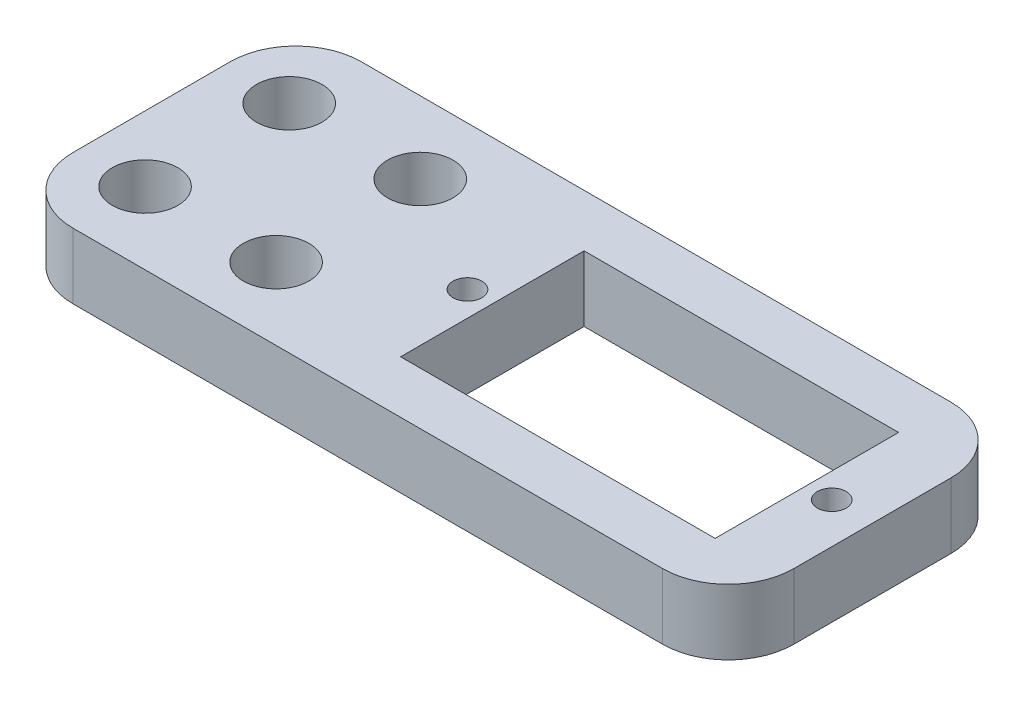
from build123d import *

# Parameters (mm, degrees)
SKETCH1_W           = 55
SKETCH1_H           = 22
BOSS_EXTRUDE1_DEPTH = 5
SKETCH2_R           = 2.5
CUT_EXTRUDE1_DEPTH  = 5
FILLET1_R           = 5
SKETCH4_R           = 1.1
SKETCH4_W           = 24
SKETCH4_H           = 14
CUT_EXTRUDE2_DEPTH  = 5


with BuildPart() as part:
    # Sketch1 → Boss-Extrude1 (new body)
    with BuildSketch(Plane(origin=(0, 0, 0), x_dir=(1, 0, 0), z_dir=(0, 1, 0))):
        with Locations((-2.5, 0)):
            Rectangle(SKETCH1_W, SKETCH1_H)
    extrude(amount=BOSS_EXTRUDE1_DEPTH)

    # Sketch2 → Cut-Extrude1 (cut)
    with BuildSketch(Plane(origin=(0, 5, 0), x_dir=(1, 0, 0), z_dir=(0, 1, 0))):
        with Locations(Location((-25, 5.5, 0), (0, 0, 270))):
            Circle(SKETCH2_R)
        with Locations(Location((-15, 5.5, 0), (0, 0, 270))):
            Circle(SKETCH2_R)
        with Locations(Location((-25, -5.5, 0), (0, 0, 270))):
            Circle(SKETCH2_R)
        with Locations(Location((-15, -5.5, 0), (0, 0, 270))):
            Circle(SKETCH2_R)
    extrude(amount=-CUT_EXTRUDE1_DEPTH, mode=Mode.SUBTRACT)

    # Fillet1
    fillet1_edges = [part.edges().sort_by_distance(p)[0] for p in [
        (-30, 2.5, -11),
        (25, 2.5, -11),
        (25, 2.5, 11),
        (-30, 2.5, 11),
    ]]
    fillet(fillet1_edges, radius=FILLET1_R)

    # Sketch4 → Cut-Extrude2 (cut)
    with BuildSketch(Plane(origin=(0, 5, 0), x_dir=(1, 0, 0), z_dir=(0, 1, 0))):
        with Locations(Location((21.9, 0, 0), (0, 0, 270))):
            Circle(SKETCH4_R)
        with Locations(Location((-5.9, 0, 0), (0, 0, 90))):
            Circle(SKETCH4_R)
        with Locations((8, 0)):
            Rectangle(SKETCH4_W, SKETCH4_H)
    extrude(amount=-CUT_EXTRUDE2_DEPTH, mode=Mode.SUBTRACT)


solid = part.part
